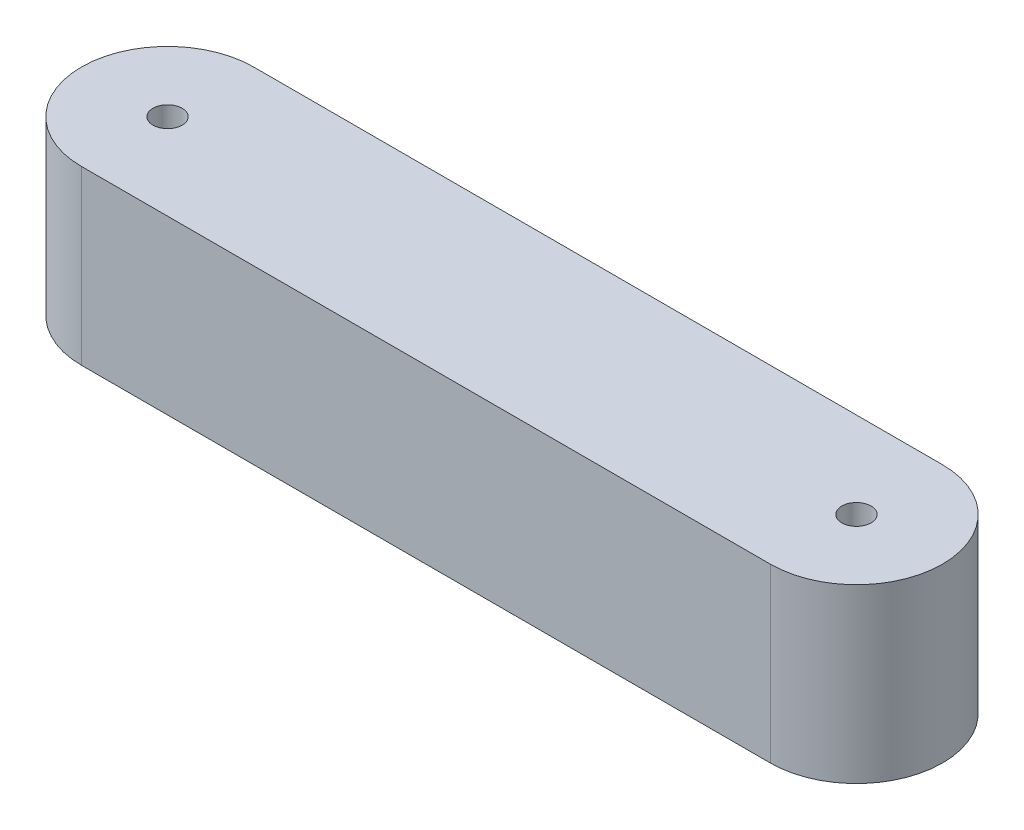
from build123d import *

# Parameters (mm, degrees)
SKETCH1_R           = 1.7
BOSS_EXTRUDE1_DEPTH = 20


with BuildPart() as part:
    # Sketch1 → Boss-Extrude1 (new body)
    with BuildSketch(Plane(origin=(0, 0, 0), x_dir=(1, 0, 0), z_dir=(0, 1, 0))):
        with BuildLine():
            Line((-40, 10), (40, 10))
            ThreePointArc((40, 10), (50, 0), (40, -10))
            Line((40, -10), (-40, -10))
            ThreePointArc((-40, -10), (-50, 0), (-40, 10))
        make_face()
        with Locations(Location((-40, 0, 0), (0, 0, 270))):
            Circle(SKETCH1_R, mode=Mode.SUBTRACT)
        with Locations(Location((40, 0, 0), (0, 0, 270))):
            Circle(SKETCH1_R, mode=Mode.SUBTRACT)
    extrude(amount=BOSS_EXTRUDE1_DEPTH)


solid = part.part
